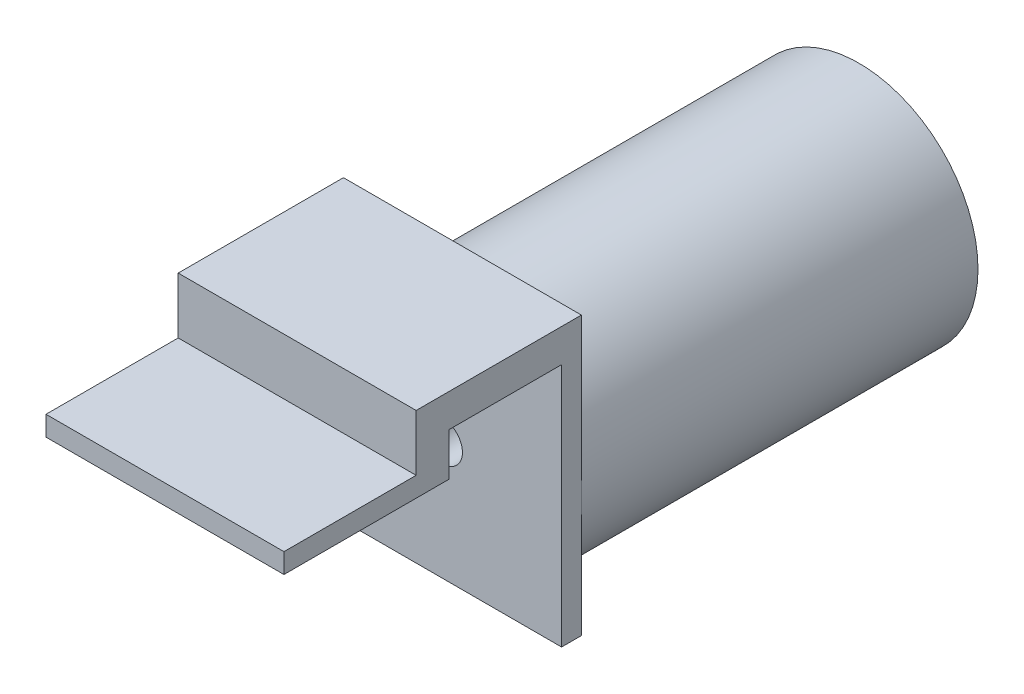
from build123d import *

# Parameters (mm, degrees)
SKETCH2_R               = 18
BOSS_EXTRUDE1_DEPTH     = 60
SKETCH4_W               = 36
SKETCH4_H               = 42
BOSS_EXTRUDE2_DEPTH     = 3
CUT_EXTRUDE1_DEPTH      = 3
CUT_EXTRUDE1_DEPTH_BACK = 60
SKETCH3_R               = 3
SKETCH6_W               = 36
SKETCH6_H               = 17
BOSS_EXTRUDE3_DEPTH     = 5
BOSS_EXTRUDE4_DEPTH     = 5
SKETCH8_W               = 36
SKETCH8_H               = 3
BOSS_EXTRUDE5_DEPTH     = 20


with BuildPart() as part:
    # Sketch2 → Boss-Extrude1 (new body)
    with BuildSketch(Plane.XY):
        Circle(SKETCH2_R)
    extrude(amount=BOSS_EXTRUDE1_DEPTH)

    # Sketch4 → Boss-Extrude2 (add)
    with BuildSketch(Plane.XY.offset(60)):
        with Locations((0, 3)):
            Rectangle(SKETCH4_W, SKETCH4_H)
    extrude(amount=BOSS_EXTRUDE2_DEPTH)

    # Sketch3 → Cut-Extrude1 (cut, two sides: drawn at the far end of the back side and taken through both)
    with BuildSketch(Plane.XY.offset(60).offset(-CUT_EXTRUDE1_DEPTH_BACK)):
        Circle(SKETCH3_R)
    extrude(amount=CUT_EXTRUDE1_DEPTH + CUT_EXTRUDE1_DEPTH_BACK, mode=Mode.SUBTRACT)

    # Sketch6 → Boss-Extrude3 (add)
    with BuildSketch(Plane(origin=(0, 24, 0), x_dir=(1, 0, 0), z_dir=(0, 1, 0))):
        with Locations((0, -71.5)):
            Rectangle(SKETCH6_W, SKETCH6_H)
    extrude(amount=-BOSS_EXTRUDE3_DEPTH)

    # Sketch7 → Boss-Extrude4 (add)
    with BuildSketch(Plane.XY.offset(80)):
        Polygon((18, 19), (18, 12.5), (-18, 12.5), (-18, 19), (-18, 24), (18, 24), align=None)
    extrude(amount=BOSS_EXTRUDE4_DEPTH)

    # Sketch8 → Boss-Extrude5 (add)
    with BuildSketch(Plane.XY.offset(85)):
        with Locations((0, 14)):
            Rectangle(SKETCH8_W, SKETCH8_H)
    extrude(amount=BOSS_EXTRUDE5_DEPTH)


solid = part.part
